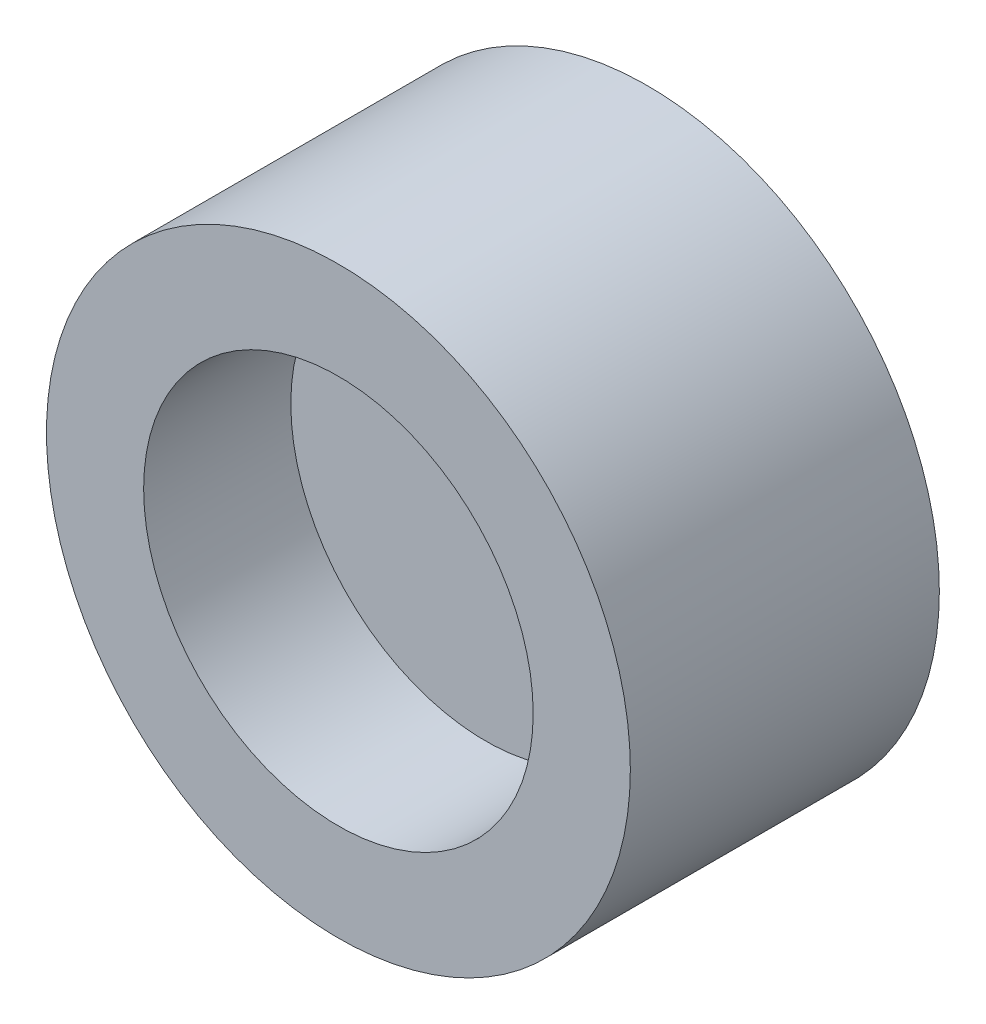
from build123d import *

# Parameters (mm, degrees)
SKETCH_1_R      = 2.5
EXTRUDE_1_DEPTH = 2.07724007
SKETCH_1_3_R    = 3.747179144
SKETCH_1_3_R_2  = 2.5
EXTRUDE_2_DEPTH = 3.966227496


with BuildPart() as part:
    # 스케치1 → 보스-돌출1 (new body)
    with BuildSketch(Plane.XY):
        Circle(SKETCH_1_R)
    extrude(amount=EXTRUDE_1_DEPTH)

    # 스케치1<3> → 보스-돌출2 (add)
    with BuildSketch(Plane.XY):
        Circle(SKETCH_1_3_R)
        Circle(SKETCH_1_3_R_2, mode=Mode.SUBTRACT)
    extrude(amount=EXTRUDE_2_DEPTH)


solid = part.part
